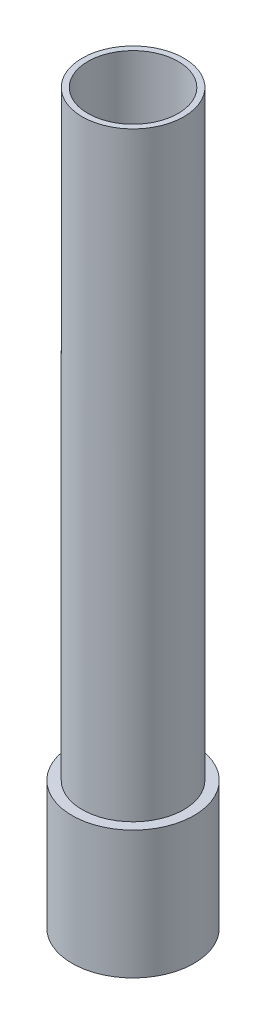
from build123d import *

# Parameters (mm, degrees)
SKETCH1_R           = 7.9375
SKETCH1_R_2         = 7.0485
BOSS_EXTRUDE1_DEPTH = 113.72
SKETCH2_R           = 9.525
SKETCH2_R_2         = 7.9375
BOSS_EXTRUDE2_DEPTH = 20


with BuildPart() as part:
    # Sketch1 → Boss-Extrude1 (new body)
    with BuildSketch(Plane(origin=(0, 0, 0), x_dir=(1, 0, 0), z_dir=(0, 1, 0))):
        with Locations(Location((13.632659162, 6.079429086, 0), (0, 0, 270))):
            Circle(SKETCH1_R)
        with Locations(Location((13.632659162, 6.079429086, 0), (0, 0, 270))):
            Circle(SKETCH1_R_2, mode=Mode.SUBTRACT)
    extrude(amount=BOSS_EXTRUDE1_DEPTH)

    # Sketch2 → Boss-Extrude2 (add)
    with BuildSketch(Plane.XZ):
        with Locations(Location((13.632659162, -6.079429086, 0), (0, 0, 270))):
            Circle(SKETCH2_R)
        with Locations(Location((13.632659162, -6.079429086, 0), (0, 0, 270))):
            Circle(SKETCH2_R_2, mode=Mode.SUBTRACT)
    extrude(amount=-BOSS_EXTRUDE2_DEPTH)


solid = part.part
